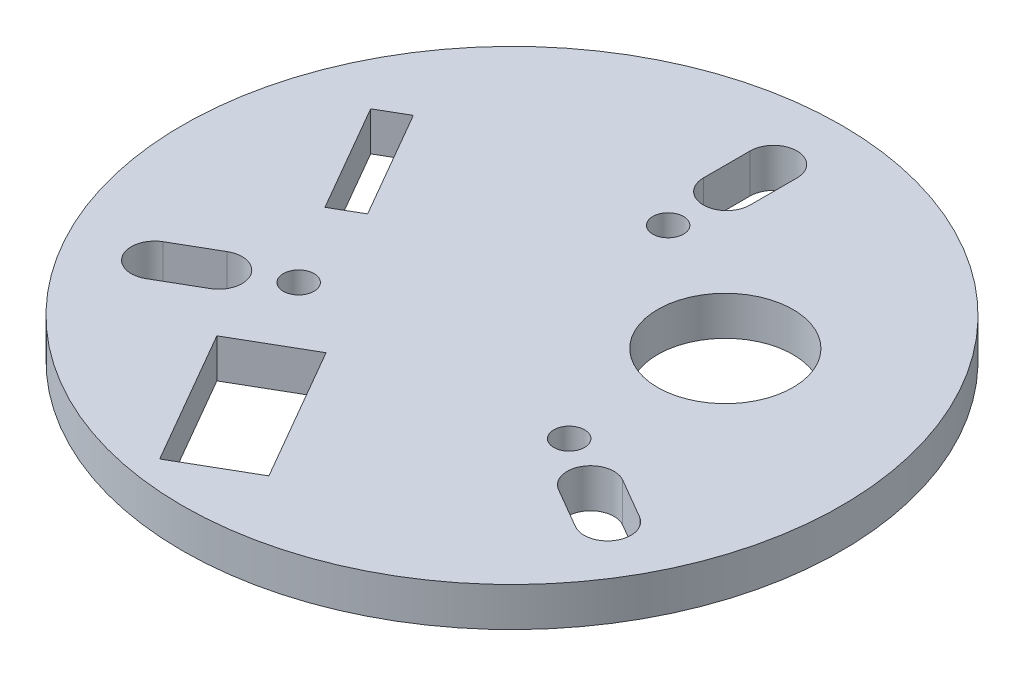
from build123d import *

# Parameters (mm, degrees)
SKETCH2_R           = 26.799999994
BOSS_EXTRUDE1_DEPTH = 3.175
SKETCH3_W           = 3.81
SKETCH3_H           = 3.81
SKETCH3_R           = 1.25
CUT_EXTRUDE1_DEPTH  = 3.175
SKETCH4_R           = 5.5
CUT_EXTRUDE2_DEPTH  = 7.62
CUT_EXTRUDE3_DEPTH  = 5.08


with BuildPart() as part:
    # Sketch2 → Boss-Extrude1 (new body)
    with BuildSketch(Plane(origin=(0, 0, 0), x_dir=(1, 0, 0), z_dir=(0, 1, 0))):
        with Locations(Location((0, 0, 0), (0, 0, 270))):
            Circle(SKETCH2_R)
    extrude(amount=BOSS_EXTRUDE1_DEPTH)

    # Sketch3 → Cut-Extrude1 (cut)
    with BuildSketch(Plane(origin=(0, 3.175, 0), x_dir=(1, 0, 0), z_dir=(0, 1, 0))):
        with Locations((-5e-05, 19.3675)):
            Rectangle(SKETCH3_W, SKETCH3_H)
        with BuildLine():
            ThreePointArc((-1.90505, 21.2725), (-5e-05, 23.1775), (1.90495, 21.2725))
            Line((1.90495, 21.2725), (-1.90505, 21.2725))
        make_face()
        with BuildLine():
            Line((-1.90505, 17.4625), (1.90495, 17.4625))
            ThreePointArc((1.90495, 17.4625), (-5e-05, 15.5575), (-1.90505, 17.4625))
        make_face()
        Polygon((16.0810614, -7.084700603), (19.374239178, -9.000706899), (17.458232881, -12.293884676), (14.165055104, -10.37787838), align=None)
        with BuildLine():
            ThreePointArc((14.165055104, -10.37787838), (13.476469363, -7.773286343), (16.0810614, -7.084700603))
            Line((16.0810614, -7.084700603), (14.165055104, -10.37787838))
        make_face()
        with BuildLine():
            Line((17.458232881, -12.293884676), (19.374239178, -9.000706899))
            ThreePointArc((19.374239178, -9.000706899), (20.062824918, -11.605298935), (17.458232881, -12.293884676))
        make_face()
        Polygon((-14.170405114, -10.381138379), (-16.075405114, -7.081581591), (-19.374961902, -8.986581591), (-17.469961902, -12.286138379), align=None)
        with BuildLine():
            Line((-14.170405114, -10.381138379), (-16.075405114, -7.081581591))
            ThreePointArc((-16.075405114, -7.081581591), (-13.473126719, -7.778859985), (-14.170405114, -10.381138379))
        make_face()
        with BuildLine():
            Line((-17.469961902, -12.286138379), (-19.374961902, -8.986581591))
            ThreePointArc((-19.374961902, -8.986581591), (-20.072240296, -11.588859985), (-17.469961902, -12.286138379))
        make_face()
        with Locations(Location((-10.998522628, -6.35, 0), (0, 0, 270))):
            Circle(SKETCH3_R)
        with Locations(Location((0, 12.7, 0), (0, 0, 270))):
            Circle(SKETCH3_R)
        with Locations(Location((10.998522628, -6.35, 0), (0, 0, 270))):
            Circle(SKETCH3_R)
    extrude(amount=-CUT_EXTRUDE1_DEPTH, mode=Mode.SUBTRACT)

    # Sketch4 → Cut-Extrude2 (cut)
    with BuildSketch(Plane(origin=(0, 3.175, 0), x_dir=(1, 0, 0), z_dir=(0, 1, 0))):
        with Locations(Location((10.998522628, 6.35, 0), (0, 0, 270))):
            Circle(SKETCH4_R)
    extrude(amount=-CUT_EXTRUDE2_DEPTH, mode=Mode.SUBTRACT)

    # Sketch5 → Cut-Extrude3 (cut)
    with BuildSketch(Plane(origin=(0, 3.175, 0), x_dir=(1, 0, 0), z_dir=(0, 1, 0))):
        Polygon((-4.216675415, -24.431543942), (1.41248971, -21.181543942), (-4.93751029, -10.183021314), (-10.566675415, -13.433021314), align=None)
        Polygon((-15.222067079, 0.010353577), (-13.022362553, 1.280353577), (-18.102362553, 10.079171679), (-20.302067079, 8.809171679), align=None)
    extrude(amount=-CUT_EXTRUDE3_DEPTH, mode=Mode.SUBTRACT)


solid = part.part
